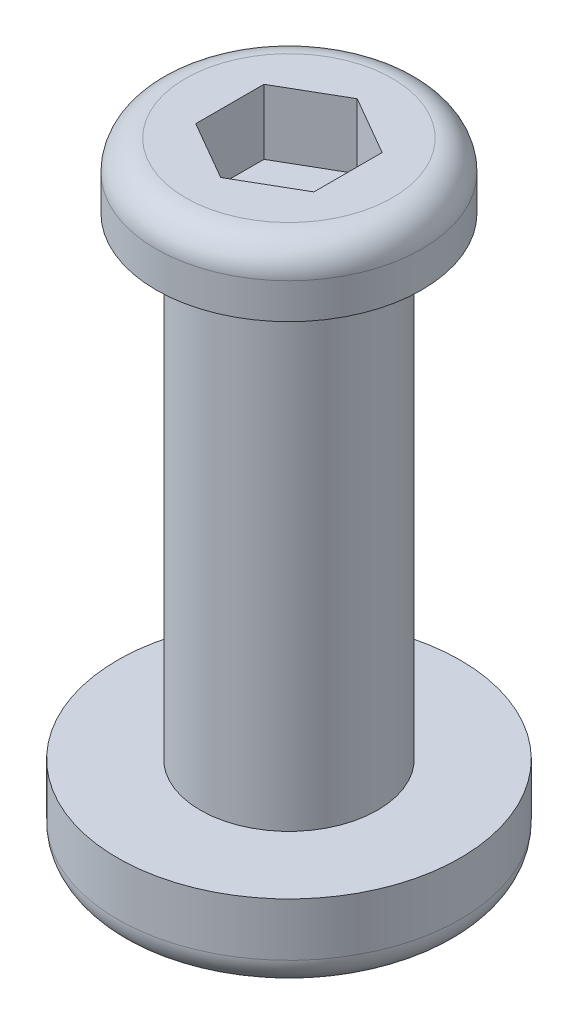
from build123d import *

# Parameters (mm, degrees)
SKETCH_1_R      = 1.5
EXTRUDE_1_DEPTH = 8
SKETCH_2_R      = 2.25
EXTRUDE_2_DEPTH = 1.1
SKETCH_3_R      = 2.9
EXTRUDE_3_DEPTH = 1.4
FILLET_1_R      = 0.5


with BuildPart() as part:
    # 草图1 → 凸台-拉伸1 (new body)
    with BuildSketch(Plane(origin=(0, 0, 0), x_dir=(1, 0, 0), z_dir=(0, 1, 0))):
        with Locations(Location((0, 0, 0), (0, 0, 270))):
            Circle(SKETCH_1_R)
    extrude(amount=EXTRUDE_1_DEPTH)

    # 草图2 → 凸台-拉伸2 (add)
    with BuildSketch(Plane(origin=(0, 8, 0), x_dir=(1, 0, 0), z_dir=(0, 1, 0))):
        with Locations(Location((0, 0, 0), (0, 0, 270))):
            Circle(SKETCH_2_R)
        Polygon((0, 1.154700538), (-1, 0.577350269), (-1, -0.577350269), (0, -1.154700538), (1, -0.577350269), (1, 0.577350269), align=None, mode=Mode.SUBTRACT)
    extrude(amount=EXTRUDE_2_DEPTH)

    # 草图3 → 凸台-拉伸3 (add)
    with BuildSketch(Plane.XZ):
        with Locations(Location((0, 0, 0), (0, 0, 270))):
            Circle(SKETCH_3_R)
        Polygon((0, 1.154700538), (-1, 0.577350269), (-1, -0.577350269), (0, -1.154700538), (1, -0.577350269), (1, 0.577350269), align=None, mode=Mode.SUBTRACT)
    extrude(amount=EXTRUDE_3_DEPTH)

    # 圆角1
    fillet_1_edges = [part.edges().sort_by_distance(p)[0] for p in [
        (0, 9.1, -2.25),
        (0, -1.4, 2.9),
    ]]
    fillet(fillet_1_edges, radius=FILLET_1_R)


solid = part.part
